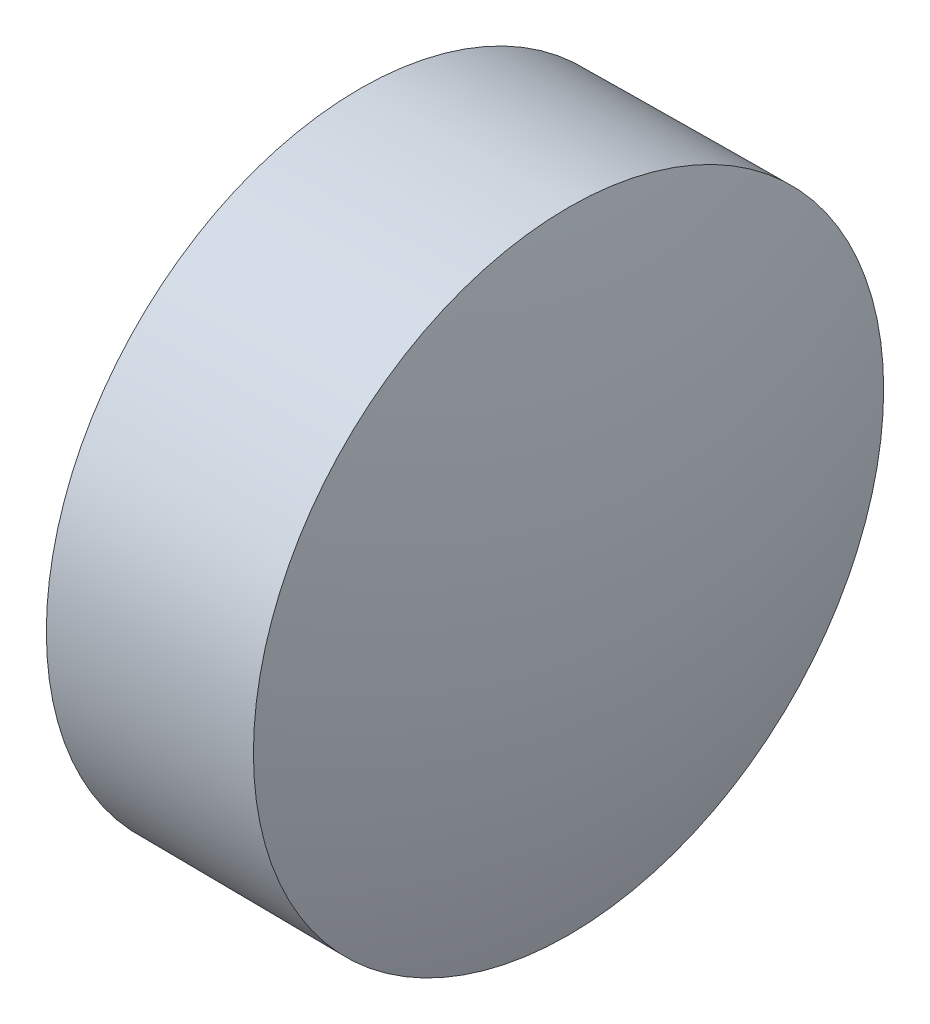
from build123d import *


with BuildPart() as part:
    # 草图1 → 旋转1 (revolve)
    with BuildSketch(Plane.XY):
        with BuildLine():
            Line((0, 0), (0.41332489, 0))
            ThreePointArc((0.41332489, 0), (0.394465804, 0.254088658), (0.338301846, 0.502608921))
            Line((0.338301846, 0.502608921), (0.005510066, 0.500121399))
            ThreePointArc((0.005510066, 0.500121399), (0.001377558, 0.250075876), (0, 0))
        make_face()
    revolve(axis=Axis((0, 0, 0), (1, 0, 0)))


solid = part.part
